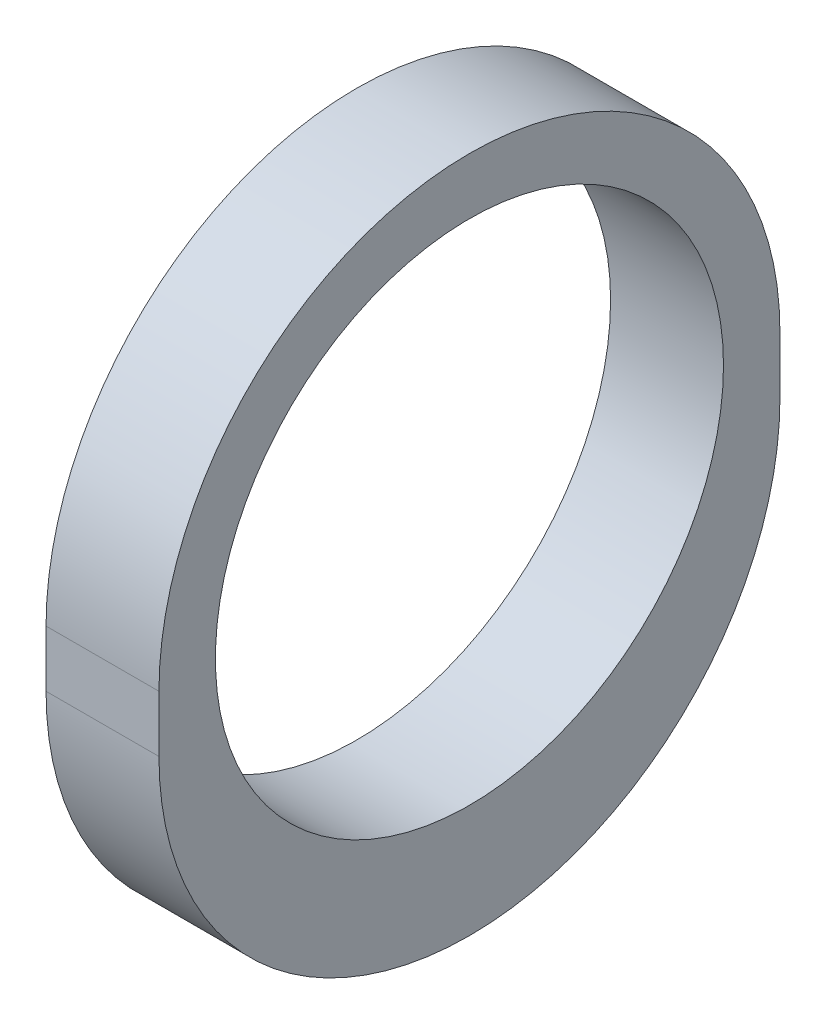
from build123d import *

# Parameters (mm, degrees)
SCHIZZO1_R                   = 9
ESTRUSIONE_ESTRUSIONE1_DEPTH = 2


with BuildPart() as part:
    # Schizzo1 → Estrusione-Estrusione1 (new, symmetric)
    with BuildSketch(Plane(origin=(0, 0, 0), x_dir=(0, 0, -1), z_dir=(1, 0, 0))):
        with BuildLine():
            Line((-11, 0), (-11, -2))
            ThreePointArc((-11, -2), (0, -13), (11, -2))
            Line((11, -2), (11, 0))
            ThreePointArc((11, 0), (0, 11), (-11, 0))
        make_face()
        Circle(SCHIZZO1_R, mode=Mode.SUBTRACT)
    extrude(amount=ESTRUSIONE_ESTRUSIONE1_DEPTH, both=True)


solid = part.part
